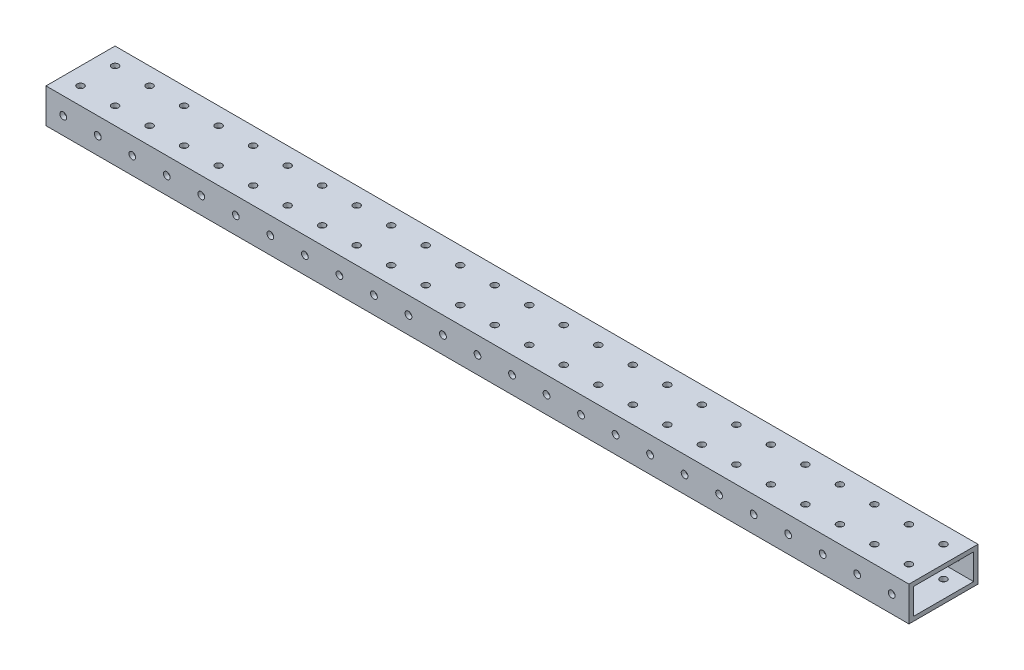
from build123d import *

# Parameters (mm, degrees)
SKETCH1_W               = 635
SKETCH1_H               = 50.8
BOSS_EXTRUDE1_DEPTH     = 25.4
SHELL1_T                = -3.175
CUT_EXTRUDE1_DEPTH      = 638.534940219
CUT_EXTRUDE1_DEPTH_BACK = 638.534940219
SKETCH2_R               = 2.4892
CUT_EXTRUDE2_DEPTH      = 638.534940219
CUT_EXTRUDE2_DEPTH_BACK = 638.534940219
SKETCH3_R               = 2.4892


with BuildPart() as part:
    # Sketch1 → Boss-Extrude1 (new body)
    with BuildSketch(Plane(origin=(0, 0, 0), x_dir=(1, 0, 0), z_dir=(0, 1, 0))):
        with Locations((317.5, 25.4)):
            Rectangle(SKETCH1_W, SKETCH1_H)
    extrude(amount=-BOSS_EXTRUDE1_DEPTH)

    # Shell1
    shell1_openings = [part.faces().sort_by_distance(p)[0] for p in [
        (635, -12.7, -25.4),
        (0, -12.7, -25.4),
    ]]
    offset(amount=SHELL1_T, openings=shell1_openings, kind=Kind.INTERSECTION)

    # Sketch2 → Cut-Extrude1 (cut, two sides: drawn at the far end of the back side and taken through both)
    with BuildSketch(Plane(origin=(0, 0, 0), x_dir=(1, 0, 0), z_dir=(0, 1, 0)).offset(-CUT_EXTRUDE1_DEPTH_BACK)):
        with Locations(Location((12.7, 38.1, 0), (0, 0, 90))):
            Circle(SKETCH2_R)
        with Locations(Location((38.1, 38.1, 0), (0, 0, 90))):
            Circle(SKETCH2_R)
        with Locations(Location((63.5, 38.1, 0), (0, 0, 90))):
            Circle(SKETCH2_R)
        with Locations(Location((88.9, 38.1, 0), (0, 0, 90))):
            Circle(SKETCH2_R)
        with Locations(Location((114.3, 38.1, 0), (0, 0, 90))):
            Circle(SKETCH2_R)
        with Locations(Location((139.7, 38.1, 0), (0, 0, 90))):
            Circle(SKETCH2_R)
        with Locations(Location((165.1, 38.1, 0), (0, 0, 90))):
            Circle(SKETCH2_R)
        with Locations(Location((190.5, 38.1, 0), (0, 0, 90))):
            Circle(SKETCH2_R)
        with Locations(Location((215.9, 38.1, 0), (0, 0, 90))):
            Circle(SKETCH2_R)
        with Locations(Location((241.3, 38.1, 0), (0, 0, 90))):
            Circle(SKETCH2_R)
        with Locations(Location((266.7, 38.1, 0), (0, 0, 90))):
            Circle(SKETCH2_R)
        with Locations(Location((292.1, 38.1, 0), (0, 0, 90))):
            Circle(SKETCH2_R)
        with Locations(Location((317.5, 38.1, 0), (0, 0, 90))):
            Circle(SKETCH2_R)
        with Locations(Location((342.9, 38.1, 0), (0, 0, 90))):
            Circle(SKETCH2_R)
        with Locations(Location((368.3, 38.1, 0), (0, 0, 90))):
            Circle(SKETCH2_R)
        with Locations(Location((38.1, 12.7, 0), (0, 0, 90))):
            Circle(SKETCH2_R)
        with Locations(Location((63.5, 12.7, 0), (0, 0, 90))):
            Circle(SKETCH2_R)
        with Locations(Location((88.9, 12.7, 0), (0, 0, 90))):
            Circle(SKETCH2_R)
        with Locations(Location((114.3, 12.7, 0), (0, 0, 90))):
            Circle(SKETCH2_R)
        with Locations(Location((139.7, 12.7, 0), (0, 0, 90))):
            Circle(SKETCH2_R)
        with Locations(Location((165.1, 12.7, 0), (0, 0, 90))):
            Circle(SKETCH2_R)
        with Locations(Location((190.5, 12.7, 0), (0, 0, 90))):
            Circle(SKETCH2_R)
        with Locations(Location((215.9, 12.7, 0), (0, 0, 90))):
            Circle(SKETCH2_R)
        with Locations(Location((241.3, 12.7, 0), (0, 0, 90))):
            Circle(SKETCH2_R)
        with Locations(Location((266.7, 12.7, 0), (0, 0, 90))):
            Circle(SKETCH2_R)
        with Locations(Location((292.1, 12.7, 0), (0, 0, 90))):
            Circle(SKETCH2_R)
        with Locations(Location((317.5, 12.7, 0), (0, 0, 90))):
            Circle(SKETCH2_R)
        with Locations(Location((342.9, 12.7, 0), (0, 0, 90))):
            Circle(SKETCH2_R)
        with Locations(Location((368.3, 12.7, 0), (0, 0, 90))):
            Circle(SKETCH2_R)
        with Locations(Location((12.7, 12.7, 0), (0, 0, 90))):
            Circle(SKETCH2_R)
        with Locations(Location((393.7, 38.1, 0), (0, 0, 90))):
            Circle(SKETCH2_R)
        with Locations(Location((419.1, 38.1, 0), (0, 0, 90))):
            Circle(SKETCH2_R)
        with Locations(Location((444.5, 38.1, 0), (0, 0, 90))):
            Circle(SKETCH2_R)
        with Locations(Location((469.9, 38.1, 0), (0, 0, 90))):
            Circle(SKETCH2_R)
        with Locations(Location((495.3, 38.1, 0), (0, 0, 90))):
            Circle(SKETCH2_R)
        with Locations(Location((520.7, 38.1, 0), (0, 0, 90))):
            Circle(SKETCH2_R)
        with Locations(Location((546.1, 38.1, 0), (0, 0, 90))):
            Circle(SKETCH2_R)
        with Locations(Location((571.5, 38.1, 0), (0, 0, 90))):
            Circle(SKETCH2_R)
        with Locations(Location((596.9, 38.1, 0), (0, 0, 90))):
            Circle(SKETCH2_R)
        with Locations(Location((622.3, 38.1, 0), (0, 0, 90))):
            Circle(SKETCH2_R)
        with Locations(Location((393.7, 12.7, 0), (0, 0, 90))):
            Circle(SKETCH2_R)
        with Locations(Location((419.1, 12.7, 0), (0, 0, 90))):
            Circle(SKETCH2_R)
        with Locations(Location((444.5, 12.7, 0), (0, 0, 90))):
            Circle(SKETCH2_R)
        with Locations(Location((469.9, 12.7, 0), (0, 0, 90))):
            Circle(SKETCH2_R)
        with Locations(Location((495.3, 12.7, 0), (0, 0, 90))):
            Circle(SKETCH2_R)
        with Locations(Location((520.7, 12.7, 0), (0, 0, 90))):
            Circle(SKETCH2_R)
        with Locations(Location((546.1, 12.7, 0), (0, 0, 90))):
            Circle(SKETCH2_R)
        with Locations(Location((571.5, 12.7, 0), (0, 0, 90))):
            Circle(SKETCH2_R)
        with Locations(Location((596.9, 12.7, 0), (0, 0, 90))):
            Circle(SKETCH2_R)
        with Locations(Location((622.3, 12.7, 0), (0, 0, 90))):
            Circle(SKETCH2_R)
    extrude(amount=CUT_EXTRUDE1_DEPTH + CUT_EXTRUDE1_DEPTH_BACK, mode=Mode.SUBTRACT)

    # Sketch3 → Cut-Extrude2 (cut, two sides: drawn at the far end of the back side and taken through both)
    with BuildSketch(Plane(origin=(0, 0, -50.8), x_dir=(-1, 0, 0), z_dir=(0, 0, -1)).offset(-CUT_EXTRUDE2_DEPTH_BACK)):
        with Locations((-12.7, -12.7)):
            Circle(SKETCH3_R)
        with Locations((-38.1, -12.7)):
            Circle(SKETCH3_R)
        with Locations((-63.5, -12.7)):
            Circle(SKETCH3_R)
        with Locations((-88.9, -12.7)):
            Circle(SKETCH3_R)
        with Locations((-114.3, -12.7)):
            Circle(SKETCH3_R)
        with Locations((-139.7, -12.7)):
            Circle(SKETCH3_R)
        with Locations((-165.1, -12.7)):
            Circle(SKETCH3_R)
        with Locations((-190.5, -12.7)):
            Circle(SKETCH3_R)
        with Locations((-215.9, -12.7)):
            Circle(SKETCH3_R)
        with Locations((-241.3, -12.7)):
            Circle(SKETCH3_R)
        with Locations((-266.7, -12.7)):
            Circle(SKETCH3_R)
        with Locations((-292.1, -12.7)):
            Circle(SKETCH3_R)
        with Locations((-317.5, -12.7)):
            Circle(SKETCH3_R)
        with Locations((-342.9, -12.7)):
            Circle(SKETCH3_R)
        with Locations((-368.3, -12.7)):
            Circle(SKETCH3_R)
        with Locations((-393.7, -12.7)):
            Circle(SKETCH3_R)
        with Locations((-419.1, -12.7)):
            Circle(SKETCH3_R)
        with Locations((-444.5, -12.7)):
            Circle(SKETCH3_R)
        with Locations((-469.9, -12.7)):
            Circle(SKETCH3_R)
        with Locations((-495.3, -12.7)):
            Circle(SKETCH3_R)
        with Locations((-520.7, -12.7)):
            Circle(SKETCH3_R)
        with Locations((-546.1, -12.7)):
            Circle(SKETCH3_R)
        with Locations((-571.5, -12.7)):
            Circle(SKETCH3_R)
        with Locations((-596.9, -12.7)):
            Circle(SKETCH3_R)
        with Locations((-622.3, -12.7)):
            Circle(SKETCH3_R)
    extrude(amount=CUT_EXTRUDE2_DEPTH + CUT_EXTRUDE2_DEPTH_BACK, mode=Mode.SUBTRACT)


solid = part.part
